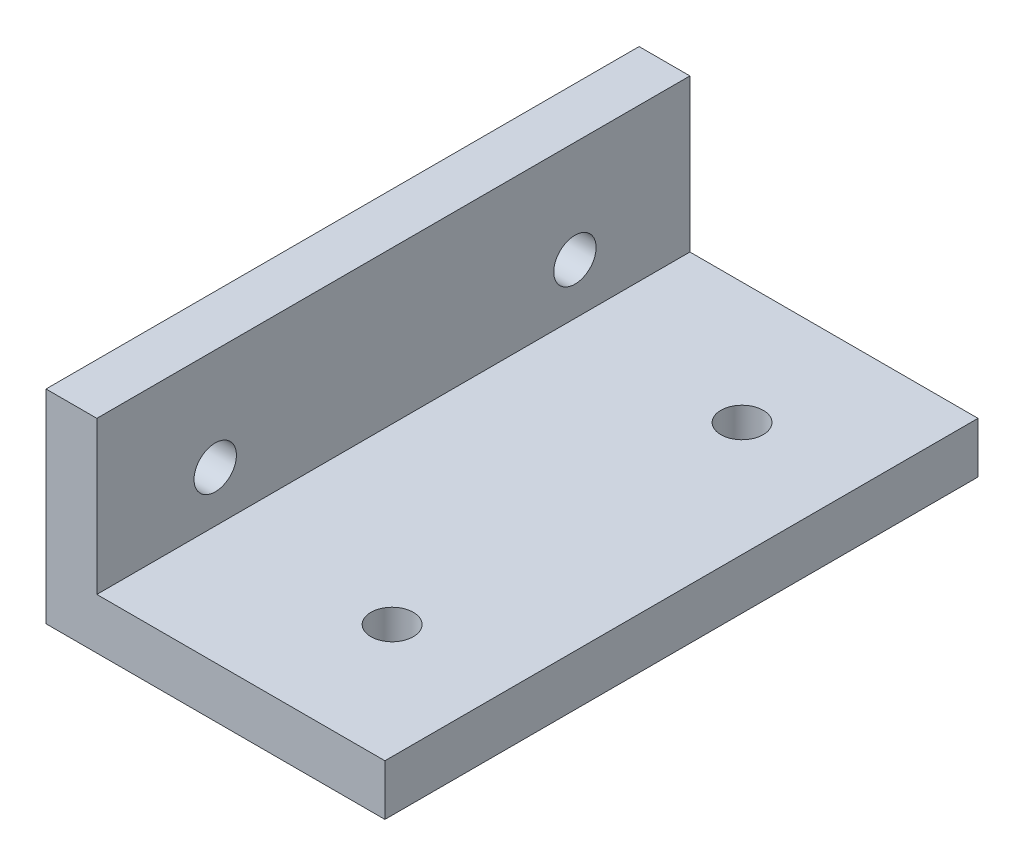
from build123d import *

# Parameters (mm, degrees)
BOSS_EXTRU_1_DEPTH    = 35
TROU_TARAUD_M31_D     = 2.5
TROU_TARAUD_M31_DEPTH = 4.9
TROU_TARAUD_M31_TIP   = 0.751075774
TROU_TARAUD_M32_D     = 2.5
TROU_TARAUD_M32_DEPTH = 4.9
TROU_TARAUD_M32_TIP   = 0.751075774


with BuildPart() as part:
    # Esquisse1 → Boss.-Extru.1 (new body)
    with BuildSketch(Plane.XY):
        Polygon((0, 0), (0, 12), (3, 12), (3, 3), (20, 3), (20, 0), align=None)
    extrude(amount=BOSS_EXTRU_1_DEPTH)

    # Trou taraudé M31
    with Locations(Plane(origin=(0, 3, 0), x_dir=(-1, 0, 0), z_dir=(0, 1, 0))):
        with Locations((-13.25, 27.824573519), (-13.25, 7.175426481)):
            Hole(TROU_TARAUD_M31_D / 2, depth=TROU_TARAUD_M31_DEPTH)
            with Locations((0, 0, -(TROU_TARAUD_M31_DEPTH + TROU_TARAUD_M31_TIP / 2))):  # 118° drill point
                Cone(0, TROU_TARAUD_M31_D / 2, TROU_TARAUD_M31_TIP, mode=Mode.SUBTRACT)

    # Trou taraudé M32
    with Locations(Plane.ZY):
        with Locations((6.786751346, 6), (28.013248654, 6)):
            Hole(TROU_TARAUD_M32_D / 2, depth=TROU_TARAUD_M32_DEPTH)
            with Locations((0, 0, -(TROU_TARAUD_M32_DEPTH + TROU_TARAUD_M32_TIP / 2))):  # 118° drill point
                Cone(0, TROU_TARAUD_M32_D / 2, TROU_TARAUD_M32_TIP, mode=Mode.SUBTRACT)


solid = part.part
